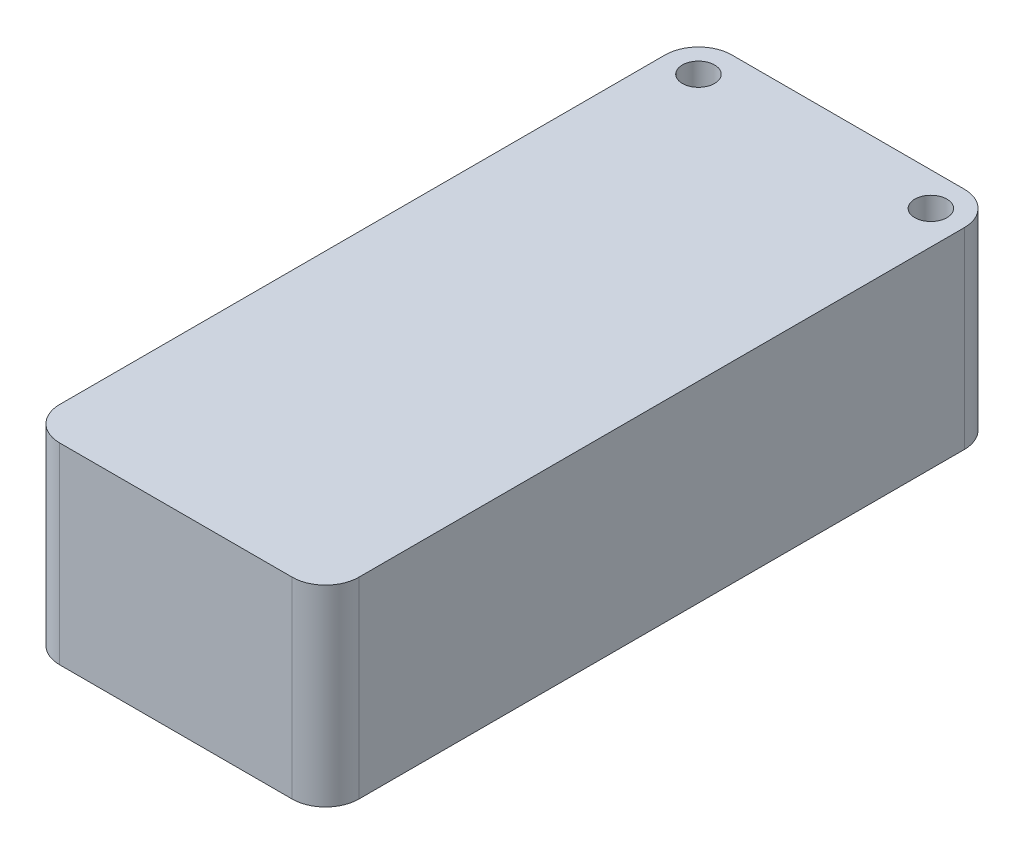
from build123d import *

# Parameters (mm, degrees)
SKETCH1_W               = 22.76
SKETCH1_H               = 51.13
BOSS_EXTRUDE1_DEPTH     = 14.62
CUT_EXTRUDE1_DEPTH      = 58.844955701
CUT_EXTRUDE1_DEPTH_BACK = 58.844955701
SKETCH2_R               = 1.225
FILLET1_R               = 2.54
SKETCH4_W               = 9
SKETCH4_H               = 3.2
BOSS_EXTRUDE3_DEPTH     = 1.12


with BuildPart() as part:
    # Sketch1 → Boss-Extrude1 (new body)
    with BuildSketch(Plane(origin=(0, 0, 0), x_dir=(1, 0, 0), z_dir=(0, 1, 0))):
        with Locations((11.38, -25.565)):
            Rectangle(SKETCH1_W, SKETCH1_H)
    extrude(amount=BOSS_EXTRUDE1_DEPTH)

    # Sketch2 → Cut-Extrude1 (cut, two sides: drawn at the far end of the back side and taken through both)
    with BuildSketch(Plane(origin=(0, 14.62, 0), x_dir=(1, 0, 0), z_dir=(0, 1, 0)).offset(-CUT_EXTRUDE1_DEPTH_BACK)):
        with Locations(Location((2.54, -2.54, 0), (0, 0, 270))):
            Circle(SKETCH2_R)
        with Locations(Location((20.22, -2.54, 0), (0, 0, 270))):
            Circle(SKETCH2_R)
    extrude(amount=CUT_EXTRUDE1_DEPTH + CUT_EXTRUDE1_DEPTH_BACK, mode=Mode.SUBTRACT)

    # Fillet1
    fillet1_edges = [part.edges().sort_by_distance(p)[0] for p in [
        (0, 7.31, 0),
        (22.76, 7.31, 0),
        (22.76, 7.31, 51.13),
        (0, 7.31, 51.13),
    ]]
    fillet(fillet1_edges, radius=FILLET1_R)

    # Sketch4 → Boss-Extrude3 (add)
    with BuildSketch(Plane(origin=(0, 0, 0), x_dir=(-1, 0, 0), z_dir=(0, 0, -1))):
        with Locations((-11.38, 10.19)):
            Rectangle(SKETCH4_W, SKETCH4_H)
    extrude(amount=BOSS_EXTRUDE3_DEPTH)


solid = part.part
